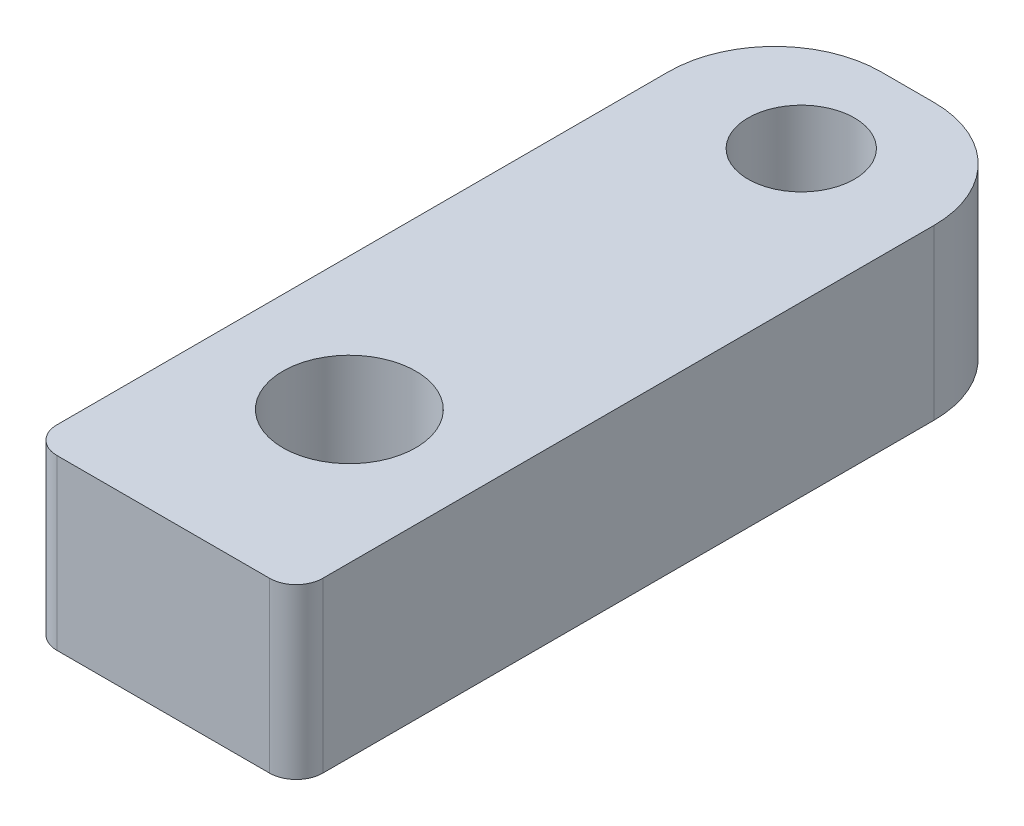
from build123d import *

# Parameters (mm, degrees)
SKETCH2_W             = 5
SKETCH2_H             = 14
SKETCH2_R             = 1
BOSS_EXTRUDE1_DEPTH   = 3.175
M3X0_5_TAPPED_HOLE1_D = 2.5
FILLET1_R             = 2
FILLET2_R             = 0.5


with BuildPart() as part:
    # Sketch2 → Boss-Extrude1 (new body)
    with BuildSketch(Plane(origin=(0, 0, 0), x_dir=(1, 0, 0), z_dir=(0, 1, 0))):
        Rectangle(SKETCH2_W, SKETCH2_H)
        with Locations(Location((0, 5, 0), (0, 0, 90))):
            Circle(SKETCH2_R, mode=Mode.SUBTRACT)
    extrude(amount=-BOSS_EXTRUDE1_DEPTH)

    # M3x0.5 Tapped Hole1 (through all)
    with Locations(Plane(origin=(0, 0, 0), x_dir=(1, 0, 0), z_dir=(0, 1, 0))):
        with Locations((0, -3.5)):
            Hole(M3X0_5_TAPPED_HOLE1_D / 2)

    # Fillet1
    fillet1_edges = [part.edges().sort_by_distance(p)[0] for p in [
        (-2.5, -1.5875, -7),
        (2.5, -1.5875, -7),
    ]]
    fillet(fillet1_edges, radius=FILLET1_R)

    # Fillet2
    fillet2_edges = [part.edges().sort_by_distance(p)[0] for p in [
        (2.5, -1.5875, 7),
        (-2.5, -1.5875, 7),
    ]]
    fillet(fillet2_edges, radius=FILLET2_R)


solid = part.part
